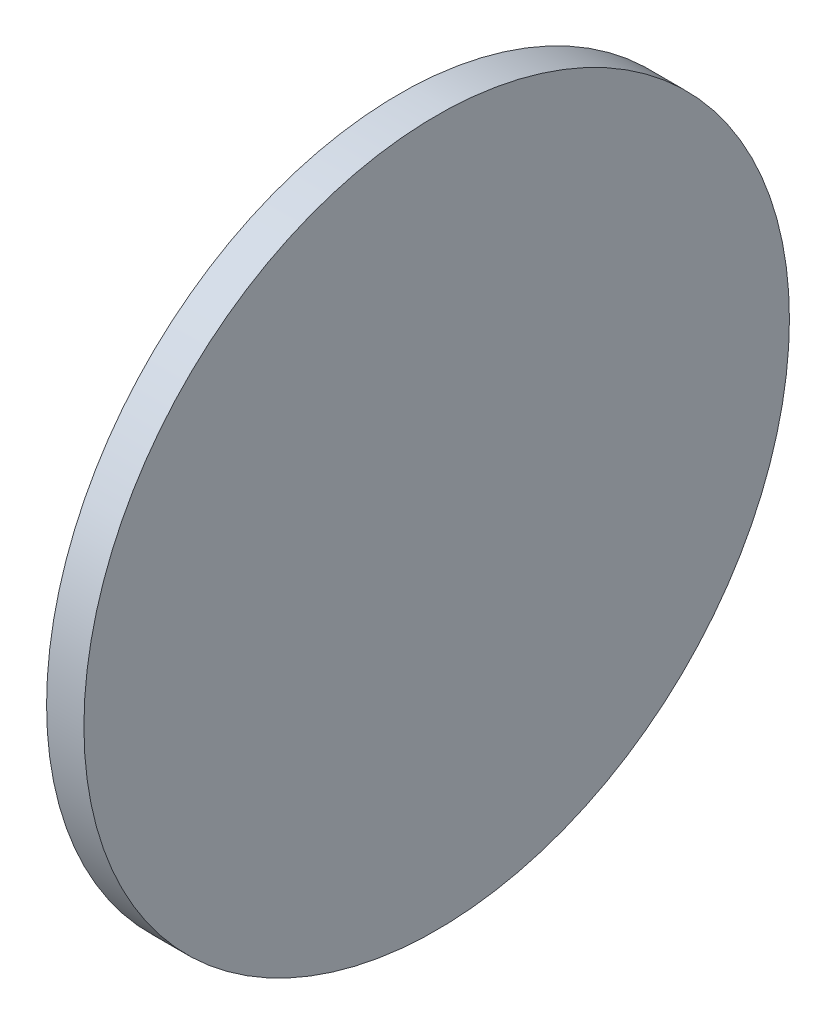
from build123d import *

# Parameters (mm, degrees)
SKETCH1_R      = 30
EXTRUDE1_DEPTH = 3.175


with BuildPart() as part:
    # Sketch1 → Extrude1 (new body)
    with BuildSketch(Plane(origin=(0, 0, 0), x_dir=(0, 0, -1), z_dir=(1, 0, 0))):
        with Locations((-1.775910693, 2.66386604)):
            Circle(SKETCH1_R)
    extrude(amount=EXTRUDE1_DEPTH)


solid = part.part
